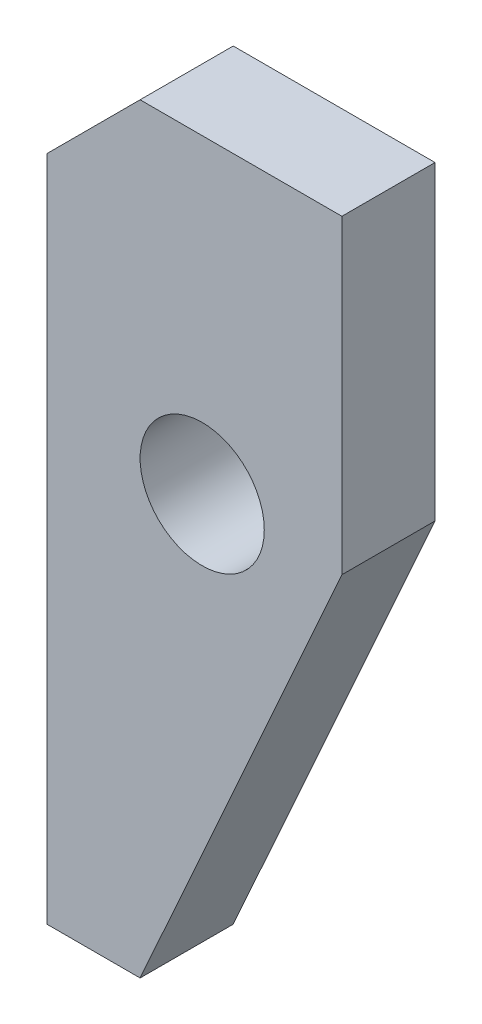
from build123d import *

# Parameters (mm, degrees)
EXTRUDE_1_DEPTH     = 30
SKETCH_2_R          = 20
CUT_EXTRUDE_1_DEPTH = 256.244980362


with BuildPart() as part:
    # 草图1 → 凸台-拉伸1 (new body)
    with BuildSketch(Plane.XY):
        Polygon((0, 0), (65, 0), (65, -100), (0, -245), (-30, -245), (-30, -30), align=None)
    extrude(amount=EXTRUDE_1_DEPTH)

    # 草图2 → 切除-拉伸1 (cut, through all)
    with BuildSketch(Plane.XY.offset(30)):
        with Locations((20, -100)):
            Circle(SKETCH_2_R)
    extrude(amount=-CUT_EXTRUDE_1_DEPTH, mode=Mode.SUBTRACT)


solid = part.part
